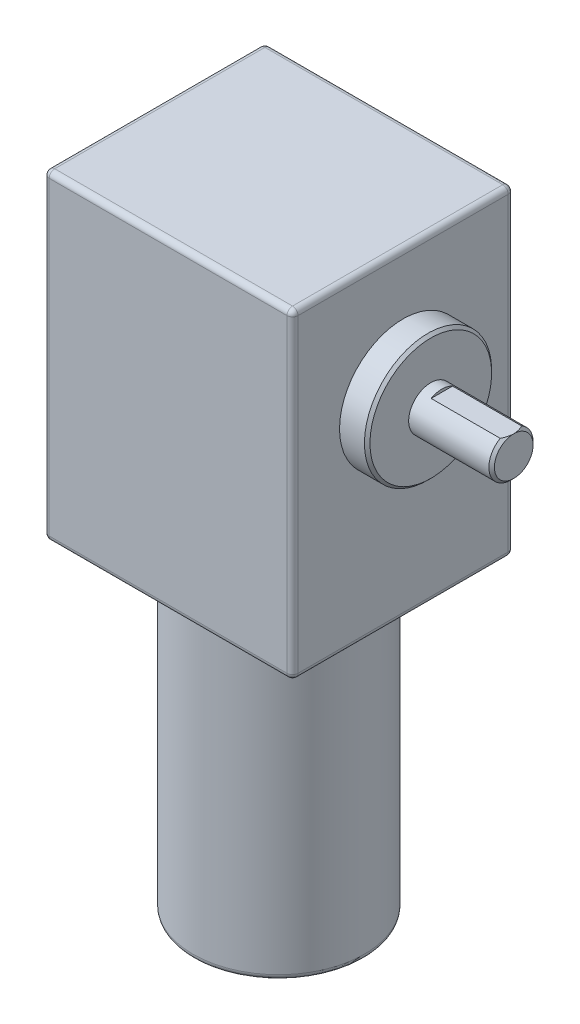
from build123d import *

# Parameters (mm, degrees)
SKETCH1_R           = 4
BOSS_EXTRUDE1_DEPTH = 15
SKETCH2_R           = 11.5
BOSS_EXTRUDE2_DEPTH = 5
SKETCH3_W           = 40
SKETCH3_H           = 58
BOSS_EXTRUDE3_DEPTH = 45
SKETCH6_R           = 15.5
BOSS_EXTRUDE4_DEPTH = 57
CHAMFER1_SIZE       = 0.5
FILLET1_R           = 1
SKETCH4_W           = 3.872983346
SKETCH4_H           = 7.5
CUT_EXTRUDE1_DEPTH  = 13


with BuildPart() as part:
    # Sketch1 → Boss-Extrude1 (new body)
    with BuildSketch(Plane(origin=(0, 0, 0), x_dir=(0, 0, -1), z_dir=(1, 0, 0))):
        Circle(SKETCH1_R)
    extrude(amount=BOSS_EXTRUDE1_DEPTH)

    # Sketch2 → Boss-Extrude2 (add)
    with BuildSketch(Plane.ZY):
        Circle(SKETCH2_R)
    extrude(amount=BOSS_EXTRUDE2_DEPTH)

    # Sketch3 → Boss-Extrude3 (add)
    with BuildSketch(Plane.ZY.offset(5)):
        with Locations((0, -6.5)):
            Rectangle(SKETCH3_W, SKETCH3_H)
    extrude(amount=BOSS_EXTRUDE3_DEPTH)

    # Sketch6 → Boss-Extrude4 (add)
    with BuildSketch(Plane.XZ.offset(35.5)):
        with Locations(Location((-27.5, 0, 0), (0, 0, 90))):
            Circle(SKETCH6_R)
    extrude(amount=BOSS_EXTRUDE4_DEPTH)

    # Chamfer1
    chamfer1_edges = [part.edges().sort_by_distance(p)[0] for p in [
        (15, 0, 4),
        (0, 0, -11.5),
    ]]
    chamfer(chamfer1_edges, length=CHAMFER1_SIZE)

    # Fillet1
    fillet1_edges = [part.edges().sort_by_distance(p)[0] for p in [
        (-27.5, 22.5, -20),
        (-5, -35.5, 0),
        (-27.5, -35.5, -20),
        (-5, -6.5, 20),
        (-27.5, -35.5, 20),
        (-5, 22.5, 0),
        (-27.5, 22.5, 20),
        (-50, -6.5, -20),
        (-50, -35.5, 0),
        (-50, -6.5, 20),
        (-50, 22.5, 0),
        (-27.5, -92.5, -15.5),
        (-5, -6.5, -20),
    ]]
    fillet(fillet1_edges, radius=FILLET1_R)

    # Sketch4 → Cut-Extrude1 (cut)
    with BuildSketch(Plane(origin=(15, 0, 0), x_dir=(0, 0, -1), z_dir=(1, 0, 0))):
        with Locations((0, 7.25)):
            Rectangle(SKETCH4_W, SKETCH4_H)
    extrude(amount=-CUT_EXTRUDE1_DEPTH, mode=Mode.SUBTRACT)


solid = part.part
